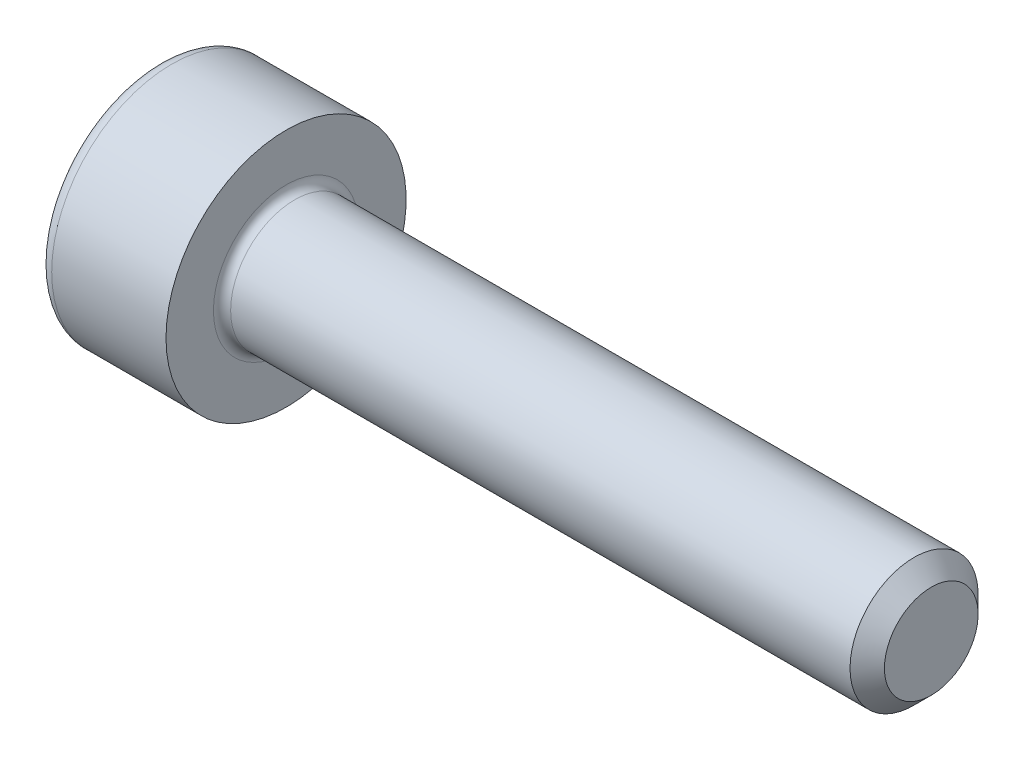
from build123d import *

# Parameters (mm, degrees)
FILLET1_R      = 0.1
FILLET2_R      = 0.16
CHAMFER1_SIZE  = 0.2
EXTRUDE1_DEPTH = 0.7


with BuildPart() as part:
    # Sketch1 → Revolve1 (revolve)
    with BuildSketch(Plane.XY, mode=Mode.PRIVATE) as revolve1_sk:
        Polygon((0, 1.395688245), (0, 0), (8.988734128, 0), (8.988734128, 0.744367064), (1.488734128, 0.744367064), (1.488734128, 1.395688245), align=None)
    revolve(revolve1_sk.sketch.rotate(Axis((0, 0, 0), (1, 0, 0)), 90), axis=Axis((0, 0, 0), (1, 0, 0)))

    # Fillet1
    fillet1_edges = [part.edges().sort_by_distance(p)[0] for p in [
        (1.488734128, 0, -0.744367064),
    ]]
    fillet(fillet1_edges, radius=FILLET1_R)

    # Fillet2
    fillet2_edges = [part.edges().sort_by_distance(p)[0] for p in [
        (0, 0, -1.395688245),
    ]]
    fillet(fillet2_edges, radius=FILLET2_R)

    # Chamfer1
    chamfer1_edges = [part.edges().sort_by_distance(p)[0] for p in [
        (8.988734128, 0, -0.744367064),
    ]]
    chamfer(chamfer1_edges, length=CHAMFER1_SIZE)

    # Sketch2 → Extrude1 (cut)
    with BuildSketch(Plane.ZY):
        Polygon((0, 0.877572409), (-0.76, 0.438786205), (-0.76, -0.438786205), (0, -0.877572409), (0.76, -0.438786205), (0.76, 0.438786205), align=None)
    extrude(amount=-EXTRUDE1_DEPTH, mode=Mode.SUBTRACT)


solid = part.part
